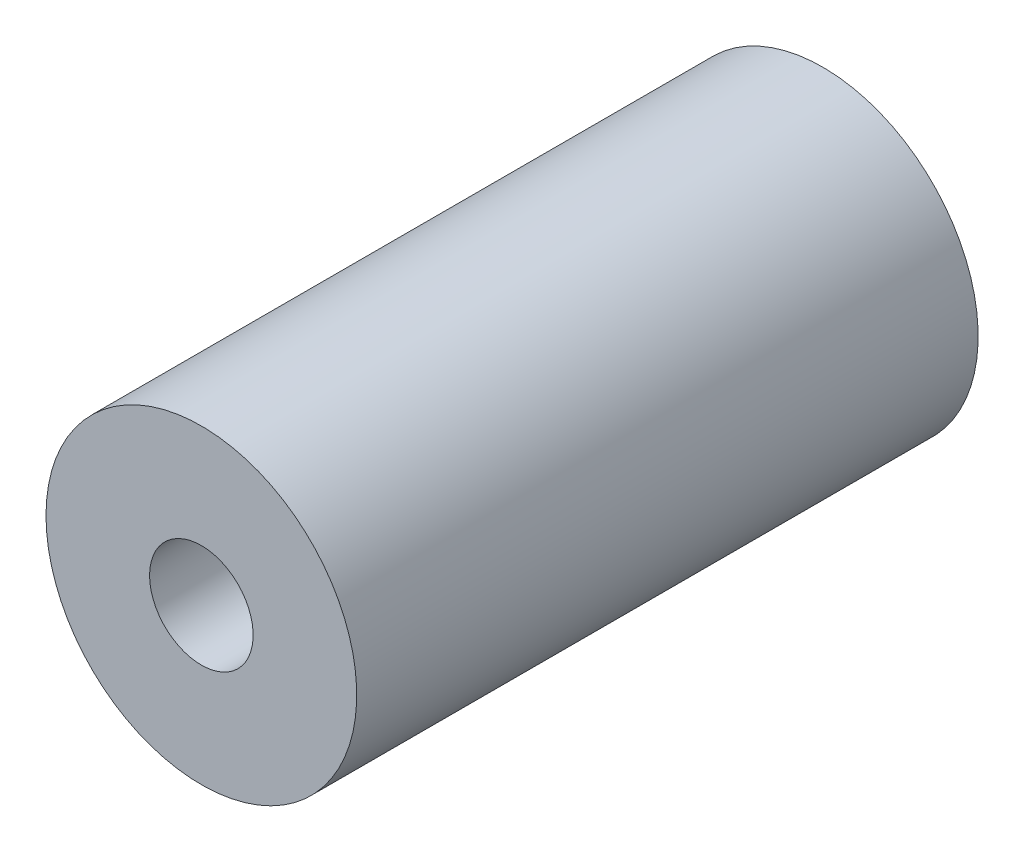
from build123d import *

# Parameters (mm, degrees)
SKETCH1_R           = 9.525
SKETCH1_R_2         = 3.175
BOSS_EXTRUDE1_DEPTH = 38.1


with BuildPart() as part:
    # Sketch1 → Boss-Extrude1 (new body)
    with BuildSketch(Plane.XY):
        with Locations(Location((0, 0, 0), (0, 0, 180))):
            Circle(SKETCH1_R)
        with Locations(Location((0, 0, 0), (0, 0, 180))):
            Circle(SKETCH1_R_2, mode=Mode.SUBTRACT)
    extrude(amount=BOSS_EXTRUDE1_DEPTH)


solid = part.part
